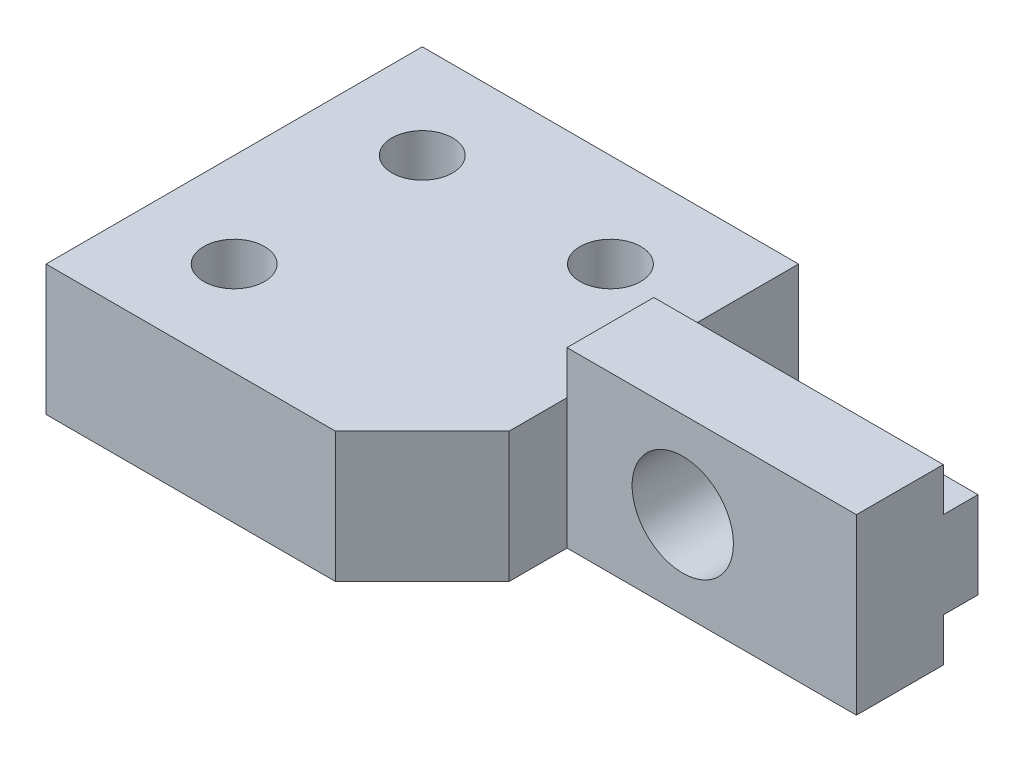
from build123d import *

# Parameters (mm, degrees)
SKETCH_2_R          = 1.05
EXTRUDE_1_DEPTH     = 6
EXTRUDE_3_DEPTH     = 10
SKETCH_5_R          = 1.75
CUT_EXTRUDE_1_DEPTH = 20.293781382
SKETCH_6_W          = 13
SKETCH_6_H          = 13
CUT_EXTRUDE_2_DEPTH = 1.5


with BuildPart() as part:
    # 草图2 → 凸台-拉伸1 (new body)
    with BuildSketch(Plane(origin=(0, 0, 0), x_dir=(1, 0, 0), z_dir=(0, 1, 0))):
        Polygon((-6.5, 3.25), (6.5, 3.25), (6.5, -6.75), (3.5, -9.75), (-6.5, -9.75), align=None)
        with Locations(Location((-3.25, 0, 0), (0, 0, 270))):
            Circle(SKETCH_2_R, mode=Mode.SUBTRACT)
        with Locations(Location((3.25, 0, 0), (0, 0, 270))):
            Circle(SKETCH_2_R, mode=Mode.SUBTRACT)
        with Locations(Location((-3.25, -6.5, 0), (0, 0, 270))):
            Circle(SKETCH_2_R, mode=Mode.SUBTRACT)
    extrude(amount=EXTRUDE_1_DEPTH)

    # 草图4 → 凸台-拉伸3 (add)
    with BuildSketch(Plane(origin=(6.5, 0, 11.5), x_dir=(0, 0, -1), z_dir=(1, 0, 0))):
        Polygon((9.75, 6), (9.75, 4.5), (10.95, 4.5), (10.95, 1.5), (9.75, 1.5), (9.75, 0), (6.75, 0), (6.75, 6), align=None)
    extrude(amount=EXTRUDE_3_DEPTH)

    # 草图5 → 切除-拉伸1 (cut, through all)
    with BuildSketch(Plane.XY.offset(4.75)):
        with Locations((10.5, 3)):
            Circle(SKETCH_5_R)
    extrude(amount=-CUT_EXTRUDE_1_DEPTH, mode=Mode.SUBTRACT)

    # 草图6 → 切除-拉伸2 (cut)
    with BuildSketch(Plane(origin=(0, 6, 0), x_dir=(1, 0, 0), z_dir=(0, 1, 0))):
        with Locations((0, -3.25)):
            Rectangle(SKETCH_6_W, SKETCH_6_H)
    extrude(amount=-CUT_EXTRUDE_2_DEPTH, mode=Mode.SUBTRACT)


solid = part.part
